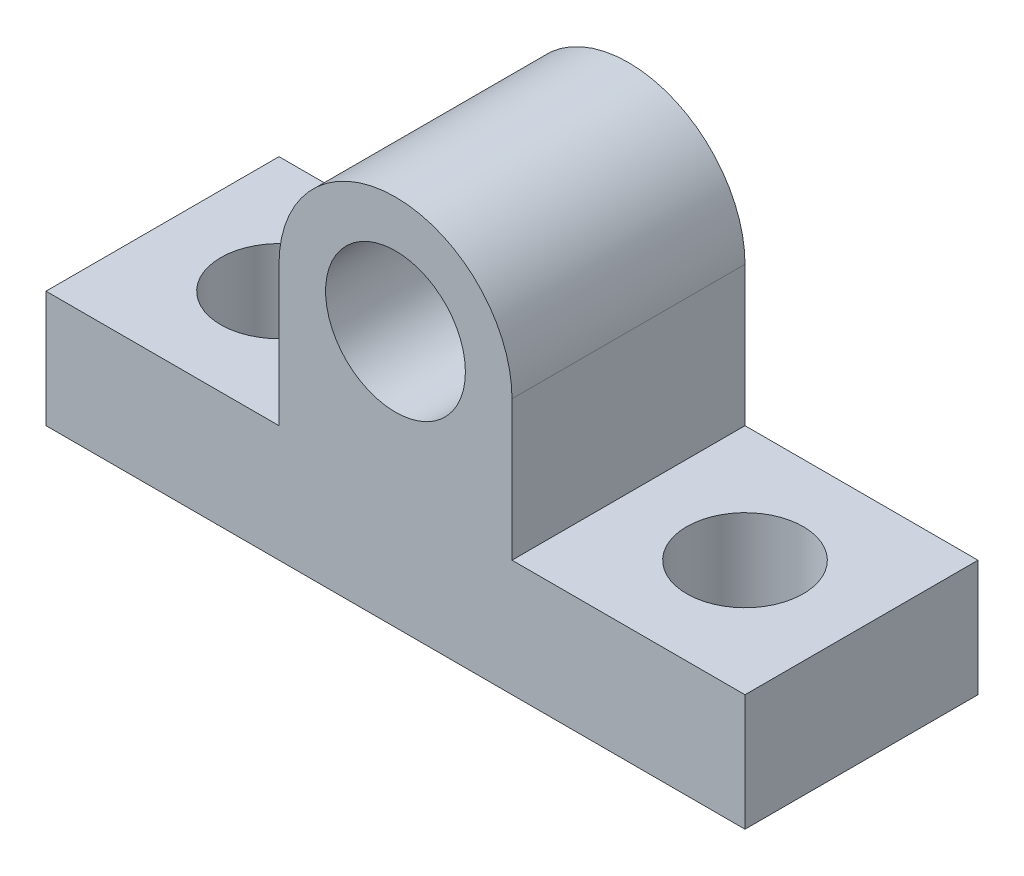
from build123d import *

# Parameters (mm, degrees)
SKETCH_1_R          = 3
EXTRUDE_1_DEPTH     = 10
SKETCH_2_R          = 2.5
CUT_EXTRUDE_1_DEPTH = 5
SKETCH_3_R          = 2.5
CUT_EXTRUDE_2_DEPTH = 5


with BuildPart() as part:
    # 草图1 → 凸台-拉伸1 (new body)
    with BuildSketch(Plane.XY):
        with BuildLine():
            Line((5, 0), (15, 0))
            Line((15, 0), (15, -5))
            Line((15, -5), (-15, -5))
            Line((-15, -5), (-15, 0))
            Line((-15, 0), (-5, 0))
            Line((-5, 0), (-5, 6))
            ThreePointArc((-5, 6), (0, 11), (5, 6))
            Line((5, 6), (5, 0))
        make_face()
        with Locations((0, 6)):
            Circle(SKETCH_1_R, mode=Mode.SUBTRACT)
    extrude(amount=EXTRUDE_1_DEPTH)

    # 草图2 → 切除-拉伸1 (cut)
    with BuildSketch(Plane(origin=(0, 0, 0), x_dir=(1, 0, 0), z_dir=(0, 1, 0))):
        with Locations(Location((-10, -5, 0), (0, 0, 180))):
            Circle(SKETCH_2_R)
    extrude(amount=-CUT_EXTRUDE_1_DEPTH, mode=Mode.SUBTRACT)

    # 草图3 → 切除-拉伸2 (cut)
    with BuildSketch(Plane(origin=(0, 0, 0), x_dir=(1, 0, 0), z_dir=(0, 1, 0))):
        with Locations(Location((10, -5, 0), (0, 0, 180))):
            Circle(SKETCH_3_R)
    extrude(amount=-CUT_EXTRUDE_2_DEPTH, mode=Mode.SUBTRACT)


solid = part.part
